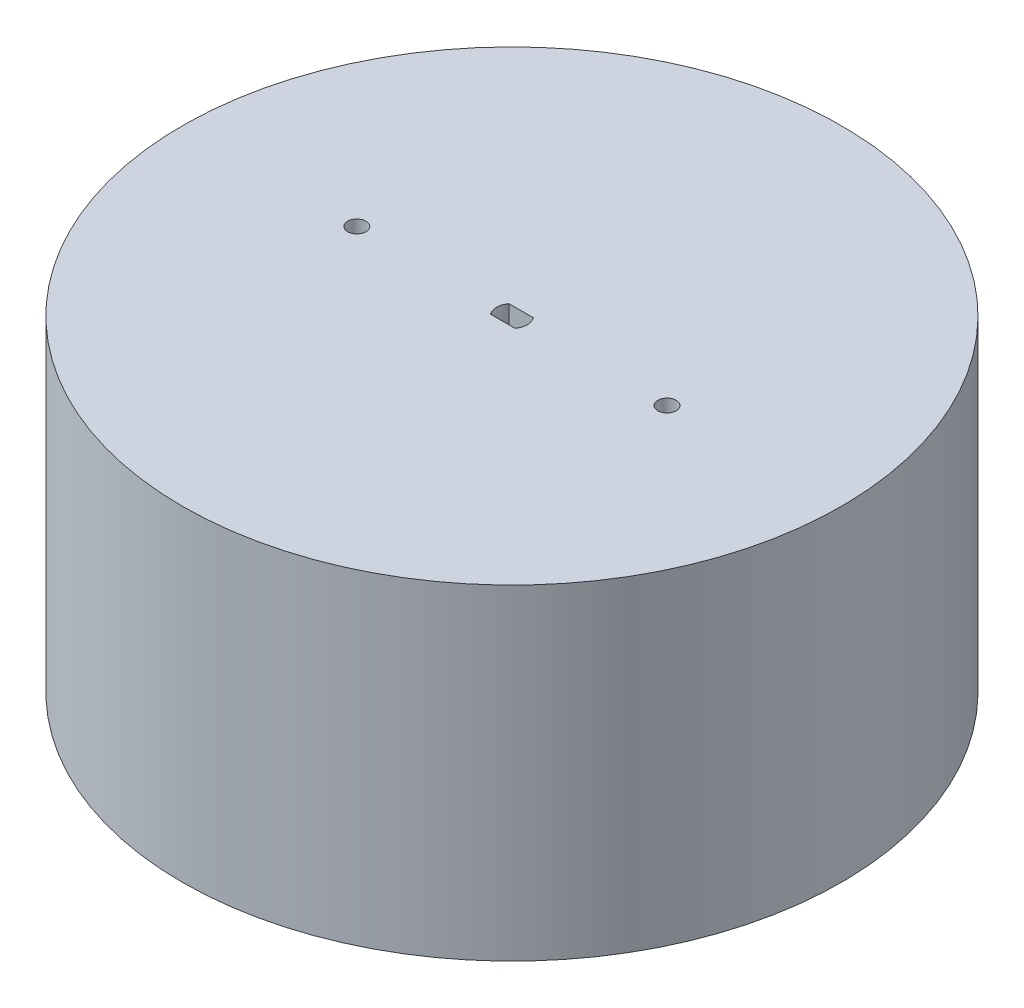
from build123d import *

# Parameters (mm, degrees)
SKETCH1_R           = 53.975
BOSS_EXTRUDE1_DEPTH = 8.89
BOSS_EXTRUDE2_START = -44.45
SKETCH1_4_R         = 53.975
SKETCH1_4_R_2       = 47.625
BOSS_EXTRUDE2_DEPTH = 44.45
CUT_EXTRUDE1_DEPTH  = 25.4
BOSS_EXTRUDE3_START = 3.4925
SKETCH3_R           = 47.625
SKETCH3_R_2         = 34.925
BOSS_EXTRUDE3_DEPTH = 3.4925
SKETCH4_R           = 1.5
CUT_EXTRUDE2_DEPTH  = 21.2725


with BuildPart() as part:
    # Sketch1 → Boss-Extrude1 (new body)
    with BuildSketch(Plane(origin=(0, 0, 0), x_dir=(1, 0, 0), z_dir=(0, 1, 0))):
        Circle(SKETCH1_R)
    extrude(amount=BOSS_EXTRUDE1_DEPTH)

    # Sketch1<4> → Boss-Extrude2 (add)
    with BuildSketch(Plane(origin=(0, 0, 0), x_dir=(1, 0, 0), z_dir=(0, 1, 0)).offset(BOSS_EXTRUDE2_START)):
        Circle(SKETCH1_4_R)
        Circle(SKETCH1_4_R_2, mode=Mode.SUBTRACT)
    extrude(amount=BOSS_EXTRUDE2_DEPTH)

    # Sketch2 → Cut-Extrude1 (cut)
    with BuildSketch(Plane(origin=(0, 8.89, 0), x_dir=(1, 0, 0), z_dir=(0, 1, 0))):
        with BuildLine():
            Line((-2, 1.5), (2, 1.5))
            ThreePointArc((2, 1.5), (2.5, 0), (2, -1.5))
            Line((2, -1.5), (-2, -1.5))
            ThreePointArc((-2, -1.5), (-2.5, 0), (-2, 1.5))
        make_face()
    extrude(amount=-CUT_EXTRUDE1_DEPTH, mode=Mode.SUBTRACT)

    # Sketch3 → Boss-Extrude3 (add)
    with BuildSketch(Plane.XZ.offset(BOSS_EXTRUDE3_START)):
        Circle(SKETCH3_R)
        Circle(SKETCH3_R_2, mode=Mode.SUBTRACT)
    extrude(amount=-BOSS_EXTRUDE3_DEPTH)

    # Sketch4 → Cut-Extrude2 (cut)
    with BuildSketch(Plane(origin=(0, 8.89, 0), x_dir=(1, 0, 0), z_dir=(0, 1, 0))):
        with Locations((25.4, 0)):
            Circle(SKETCH4_R)
        with Locations((-25.4, 0)):
            Circle(SKETCH4_R)
    extrude(amount=-CUT_EXTRUDE2_DEPTH, mode=Mode.SUBTRACT)


solid = part.part
